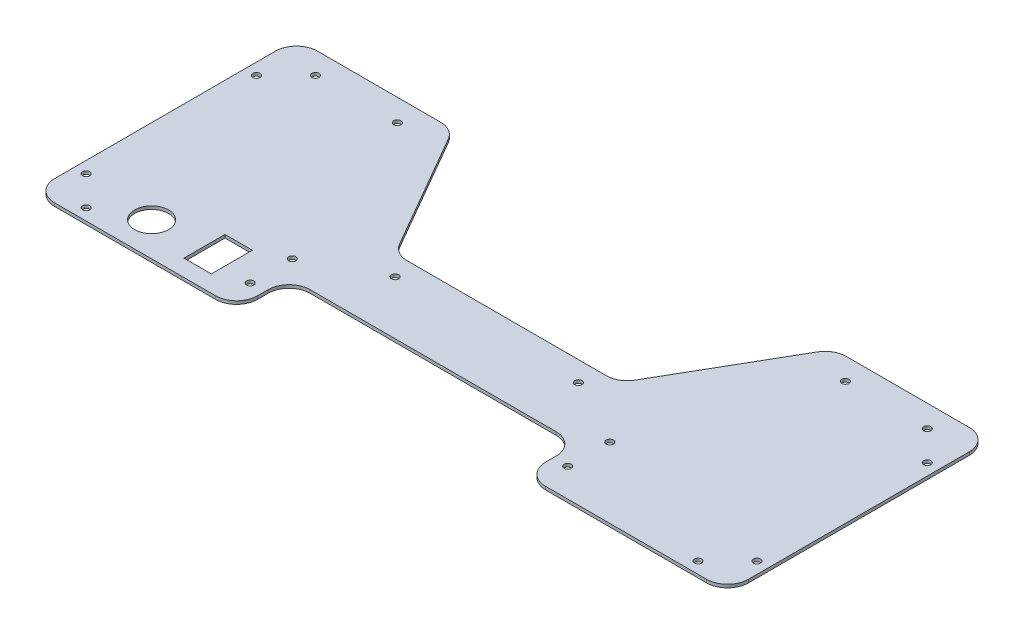
from build123d import *

# Parameters (mm, degrees)
BOSS_EXTRU_1_DEPTH      = 1.5
CONG_2_R                = 10
D_GAGEMENT_M31_D        = 3.4
ESQUISSE4_R             = 8.1
ESQUISSE4_W             = 13
ESQUISSE4_H             = 19.5
ENL_V_MAT_EXTRU_1_DEPTH = 191.400236344


with BuildPart() as part:
    # Esquisse1 → Boss.-Extru.1 (new body)
    with BuildSketch(Plane(origin=(0, 0, 0), x_dir=(1, 0, 0), z_dir=(0, 1, 0))):
        Polygon((-165, -30), (-68.5, -30), (-68.5, -5), (68.5, -5), (68.5, -30), (165, -30), (165, 90), (165, 95), (90.641016151, 95), (53.113248654, 30), (-53.113248654, 30), (-90.641016151, 95), (-165, 95), (-165, 90), align=None)
    extrude(amount=BOSS_EXTRU_1_DEPTH)

    # Congé2
    cong_2_edges = [part.edges().sort_by_distance(p)[0] for p in [
        (68.5, 0.75, 30),
        (68.5, 0.75, 5),
        (-68.5, 0.75, 5),
        (-68.5, 0.75, 30),
        (-165, 0.75, 30),
        (-165, 0.75, -95),
        (-90.641016151, 0.75, -95),
        (-53.113248654, 0.75, -30),
        (53.113248654, 0.75, -30),
        (90.641016151, 0.75, -95),
        (165, 0.75, -95),
        (165, 0.75, 30),
    ]]
    fillet(cong_2_edges, radius=CONG_2_R)

    # Dégagement M31 (through all)
    with Locations(Plane(origin=(0, 1.5, 0), x_dir=(1, 0, 0), z_dir=(0, 1, 0))):
        with Locations((-75.5, -16.5), (-75.5, 3.5), (75.5, -16.5), (75.5, 3.5), (-145.5, -24.5), (-159.5, -10.5), (-159.5, 70.5), (-145.5, 84.5), (145.5, -24.5), (159.5, -10.5), (145.5, 84.5), (159.5, 70.5), (-43.58, 20.5), (43.58, 20.5), (-106.53, 84.5), (106.53, 84.5)):
            Hole(D_GAGEMENT_M31_D / 2)

    # Esquisse4 → Enlèv. mat.-Extru.1 (cut, through all)
    with BuildSketch(Plane(origin=(0, 1.5, 0), x_dir=(1, 0, 0), z_dir=(0, 1, 0))):
        with Locations(Location((-125, -13.9, 0), (0, 0, 270))):
            Circle(ESQUISSE4_R)
        with Locations((-95, -12.25)):
            Rectangle(ESQUISSE4_W, ESQUISSE4_H)
    extrude(amount=-ENL_V_MAT_EXTRU_1_DEPTH, mode=Mode.SUBTRACT)


solid = part.part
